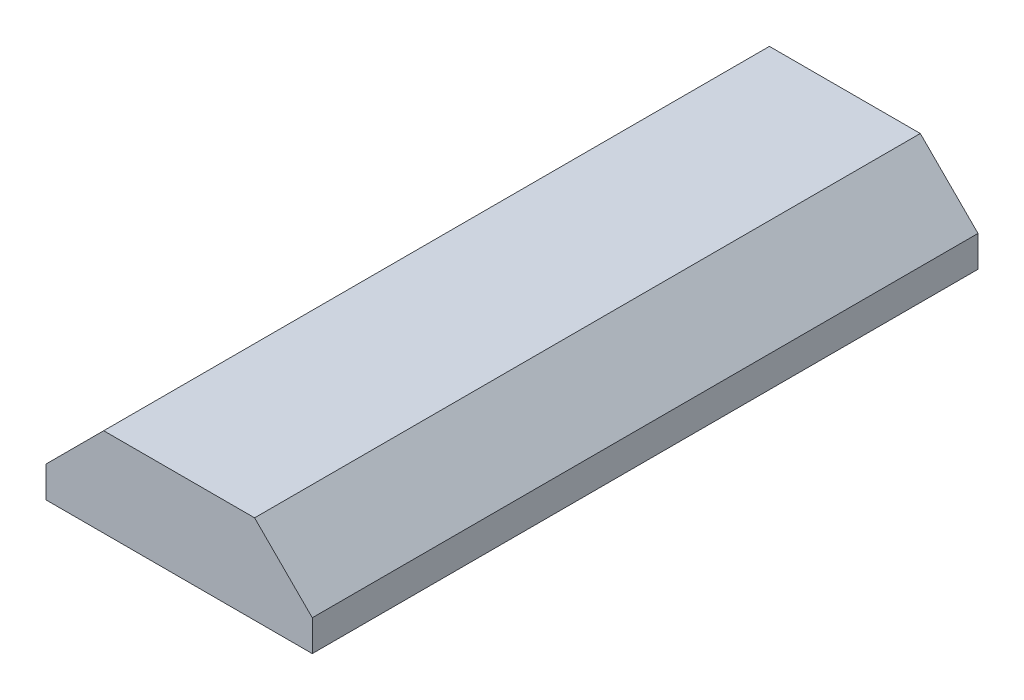
from build123d import *

# Parameters (mm, degrees)
AUFSATZ_LINEAR_AUSTRAGEN1_DEPTH = 30


with BuildPart() as part:
    # Skizze1 → Aufsatz-Linear austragen1 (new body)
    with BuildSketch(Plane.XY):
        Polygon((3.4, 1.808858787), (-3.4, 1.808858787), (-6, -0.791141213), (-6, -2.191141213), (6, -2.191141213), (6, -0.791141213), align=None)
    extrude(amount=AUFSATZ_LINEAR_AUSTRAGEN1_DEPTH)


solid = part.part
